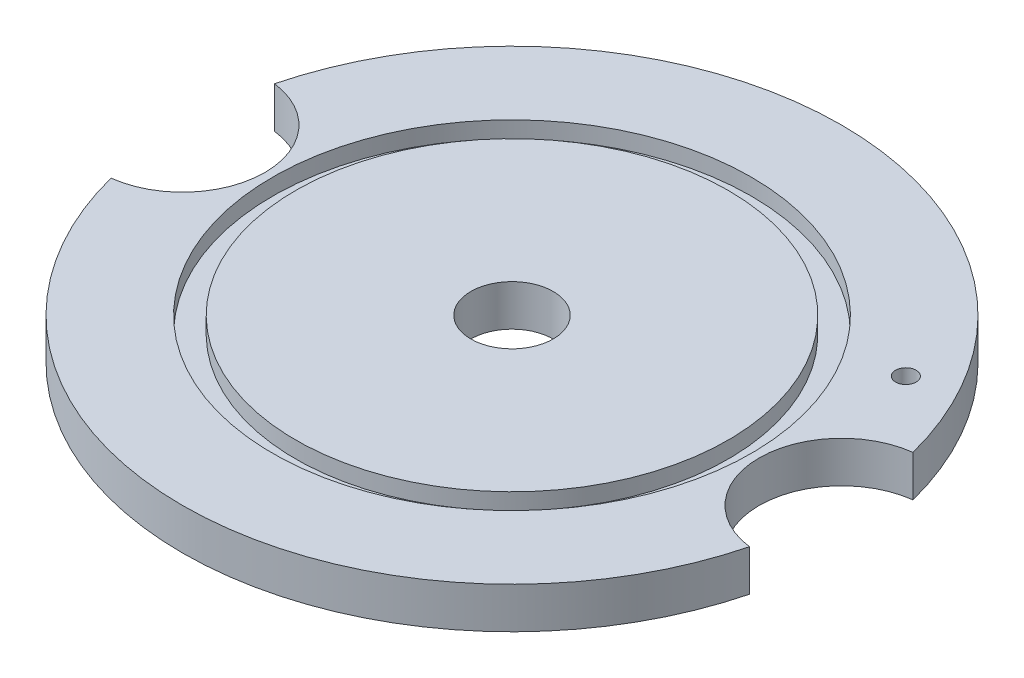
from build123d import *

# Parameters (mm, degrees)
F_1_2_0_5_DIAMETER_HOLE1_D   = 12.7
F_1_1_DIAMETER_HOLE1_D       = 25.4
F_1_8_0_125_DIAMETER_HOLE1_D = 3.175


with BuildPart() as part:
    # Sketch1 → Revolve1 (revolve)
    with BuildSketch(Plane.XY, mode=Mode.PRIVATE) as revolve1_sk:
        Polygon((-33.3375, 6.35), (-33.3375, 3.81), (-36.8935, 3.81), (-36.8935, 6.35), (-50.8, 6.35), (-50.8, 0), (0, 0), (0, 6.35), align=None)
    revolve(revolve1_sk.sketch.rotate(Axis((0, 0, 0), (0, 1, 0)), 270), axis=Axis((0, 0, 0), (0, 1, 0)))

    # 1/2 (0.5) Diameter Hole1 (through all)
    with Locations(Plane(origin=(0, 6.35, 0), x_dir=(1, 0, 0), z_dir=(0, 1, 0))):
        with Locations((0, 0)):
            Hole(F_1_2_0_5_DIAMETER_HOLE1_D / 2)

    # 1 (1) Diameter Hole1 (through all)
    with Locations(Plane(origin=(0, 6.35, 0), x_dir=(1, 0, 0), z_dir=(0, 1, 0))):
        with Locations((50.8, 0), (-50.8, 0)):
            Hole(F_1_1_DIAMETER_HOLE1_D / 2)

    # 1/8 (0.125) Diameter Hole1 (through all)
    with Locations(Plane(origin=(0, 6.35, 0), x_dir=(1, 0, 0), z_dir=(0, 1, 0))):
        with Locations((38.494829198, 22.225)):
            Hole(F_1_8_0_125_DIAMETER_HOLE1_D / 2)


solid = part.part
